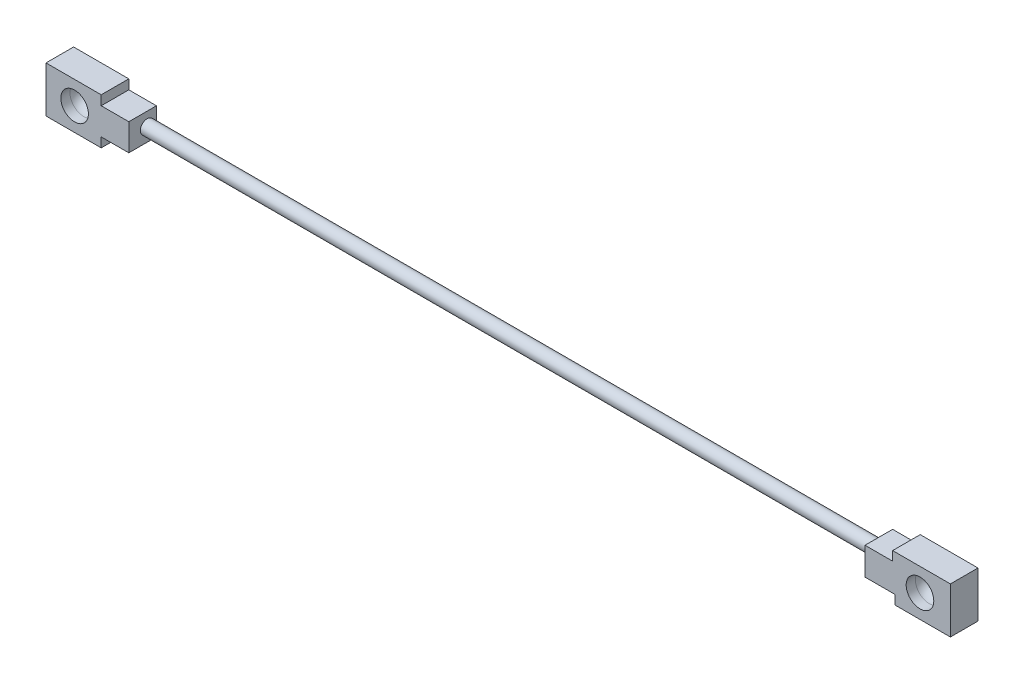
from build123d import *

# Parameters (mm, degrees)
BOSS_EXTRUDE1_DEPTH = 3
SKETCH2_R           = 1.5
CUT_EXTRUDE1_DEPTH  = 1
SKETCH3_R           = 0.75
BOSS_EXTRUDE2_DEPTH = 80
BOSS_EXTRUDE3_DEPTH = 3
SKETCH7_R           = 1.5
CUT_EXTRUDE2_DEPTH  = 1


with BuildPart() as part:
    # Sketch1 → Boss-Extrude1 (new body)
    with BuildSketch(Plane.XY):
        Polygon((-3.106795218, -2.5), (-3.106795218, 2.5), (2.893204782, 2.5), (2.893204782, 1.464436404), (5.893204782, 1.464436404), (5.893204782, -1.464436404), (2.893204782, -1.464436404), (2.893204782, -2.5), align=None)
    extrude(amount=BOSS_EXTRUDE1_DEPTH)

    # Sketch2 → Cut-Extrude1 (cut)
    with BuildSketch(Plane.XY.offset(3)):
        Circle(SKETCH2_R)
    extrude(amount=-CUT_EXTRUDE1_DEPTH, mode=Mode.SUBTRACT)

    # Sketch3 → Boss-Extrude2 (add)
    with BuildSketch(Plane(origin=(5.893204782, 0, 0), x_dir=(0, 0, -1), z_dir=(1, 0, 0))):
        with Locations(Location((-1, 0, 0), (0, 0, 180))):
            Circle(SKETCH3_R)
    extrude(amount=BOSS_EXTRUDE2_DEPTH)

    # Sketch4 → Boss-Extrude3 (add)
    with BuildSketch(Plane.XY):
        Polygon((85.893204782, 0.75), (85.893204782, 1.606881618), (88.893204782, 1.606881618), (88.893204782, 2.606881618), (95.170891527, 2.606881618), (95.170891527, -2.393118382), (89.170891527, -2.393118382), (89.170891527, -1.393118382), (85.893204782, -1.393118382), (85.893204782, -0.75), align=None)
    extrude(amount=BOSS_EXTRUDE3_DEPTH)

    # Sketch7 → Cut-Extrude2 (cut)
    with BuildSketch(Plane.XY.offset(3)):
        with Locations((91.865552177, 0.106881618)):
            Circle(SKETCH7_R)
    extrude(amount=-CUT_EXTRUDE2_DEPTH, mode=Mode.SUBTRACT)

    # Sketch8 → Cut-Revolve1 (revolve, cut)
    with BuildSketch(Plane.XY.offset(2)):
        with BuildLine():
            Line((91.865552177, 1.606881618), (91.865552177, -1.393118382))
            ThreePointArc((91.865552177, -1.393118382), (93.365552177, 0.106881618), (91.865552177, 1.606881618))
        make_face()
    revolve(axis=Axis((91.865552177, -999.893118382, 2), (0, 1, 0)), mode=Mode.SUBTRACT)

    # Sketch9 → Cut-Revolve2 (revolve, cut)
    with BuildSketch(Plane.XY.offset(2)):
        with BuildLine():
            Line((0, 1.5), (0, -1.5))
            ThreePointArc((0, -1.5), (1.5, 0), (0, 1.5))
        make_face()
    revolve(axis=Axis((0, -1000, 2), (0, 1, 0)), mode=Mode.SUBTRACT)


solid = part.part
